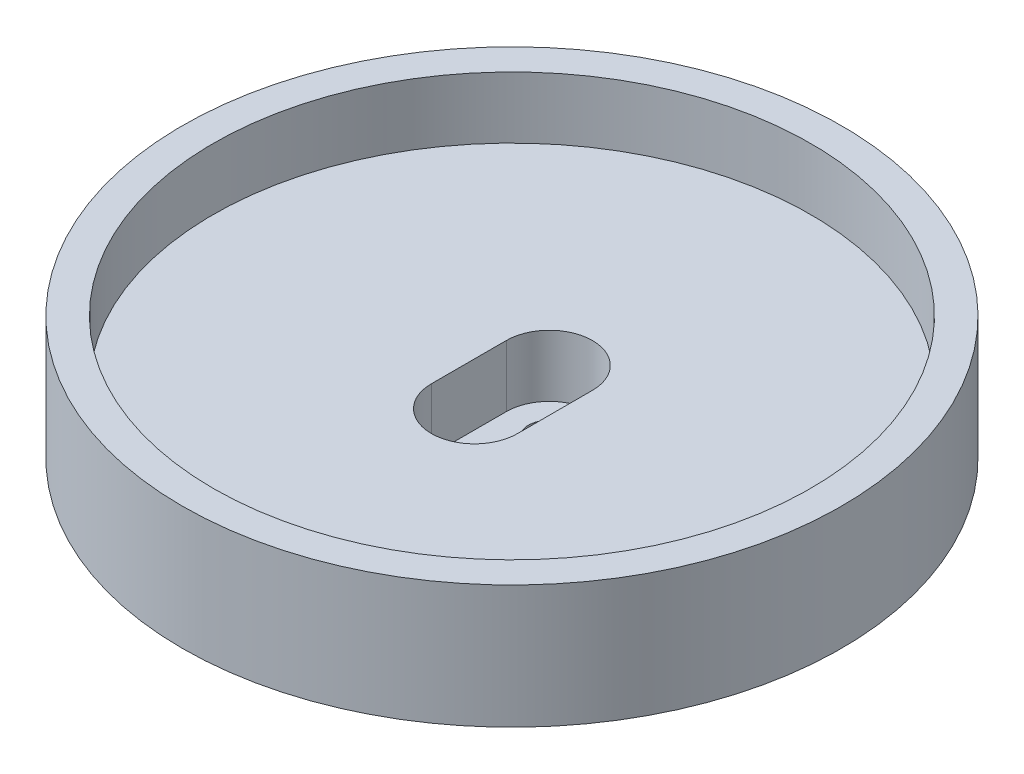
from build123d import *

# Parameters (mm, degrees)
SKETCH1_R           = 26.75
BOSS_EXTRUDE1_DEPTH = 10
SKETCH2_R           = 24.25
CUT_EXTRUDE3_DEPTH  = 5
CUT_EXTRUDE5_DEPTH  = 6
SKETCH8_W           = 12
SKETCH8_H           = 20
BOSS_EXTRUDE2_DEPTH = 4
SKETCH9_R           = 1.65
CUT_EXTRUDE6_DEPTH  = 15
SKETCH9_3_R         = 1.65
CUT_EXTRUDE7_DEPTH  = 15


with BuildPart() as part:
    # Sketch1 → Boss-Extrude1 (new body)
    with BuildSketch(Plane(origin=(0, 0, 0), x_dir=(1, 0, 0), z_dir=(0, 1, 0))):
        Circle(SKETCH1_R)
    extrude(amount=BOSS_EXTRUDE1_DEPTH)

    # Sketch2 → Cut-Extrude3 (cut)
    with BuildSketch(Plane(origin=(0, 10, 0), x_dir=(1, 0, 0), z_dir=(0, 1, 0))):
        Circle(SKETCH2_R)
    extrude(amount=-CUT_EXTRUDE3_DEPTH, mode=Mode.SUBTRACT)

    # Sketch3 → Cut-Extrude5 (cut)
    with BuildSketch(Plane(origin=(0, 5, 0), x_dir=(1, 0, 0), z_dir=(0, 1, 0))):
        with BuildLine():
            Line((3.5, 3.039080618), (3.5, -3.039080618))
            ThreePointArc((3.5, -3.039080618), (0, -6.539080618), (-3.5, -3.039080618))
            Line((-3.5, -3.039080618), (-3.5, 3.039080618))
            ThreePointArc((-3.5, 3.039080618), (0, 6.539080618), (3.5, 3.039080618))
        make_face()
    extrude(amount=-CUT_EXTRUDE5_DEPTH, mode=Mode.SUBTRACT)

    # Sketch8 → Boss-Extrude2 (add)
    with BuildSketch(Plane.XZ):
        Rectangle(SKETCH8_W, SKETCH8_H)
    extrude(amount=BOSS_EXTRUDE2_DEPTH)

    # Sketch9 → Cut-Extrude6 (cut)
    with BuildSketch(Plane(origin=(0, 0, 0), x_dir=(1, 0, 0), z_dir=(0, 1, 0))):
        with Locations((0, 3)):
            Circle(SKETCH9_R)
    extrude(amount=-CUT_EXTRUDE6_DEPTH, mode=Mode.SUBTRACT)

    # Sketch9<3> → Cut-Extrude7 (cut)
    with BuildSketch(Plane(origin=(0, 0, 0), x_dir=(1, 0, 0), z_dir=(0, 1, 0))):
        with Locations((0, 3)):
            Circle(SKETCH9_3_R)
        with Locations((0, -3)):
            Circle(SKETCH9_3_R)
    extrude(amount=-CUT_EXTRUDE7_DEPTH, mode=Mode.SUBTRACT)


solid = part.part
